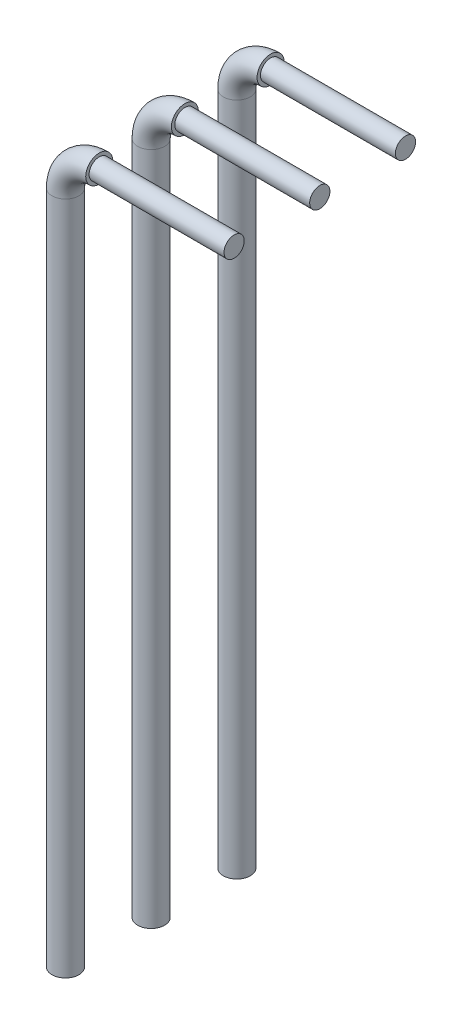
from build123d import *

# Parameters (mm, degrees)
ESQUISSE2_R                = 0.4
ESQUISSE3_R                = 0.3
BOSS_EXTRU_1_DEPTH         = 4
R_P_TITION_LIN_AIRE2_COUNT = 3
R_P_TITION_LIN_AIRE2_PITCH = 2.54


with BuildPart() as part:
    # Balayage1: sweep along a path in Esquisse1
    with BuildLine(Plane.XY) as balayage1_path:
        Line((0, 0), (0, 20))
        ThreePointArc((0, 20), (0.293142298, 20.707355773), (1.000704378, 20.999999752))
    # Esquisse2 → Balayage1 (sweep)
    with BuildSketch(Plane(origin=(0, 0, 0), x_dir=(1, 0, 0), z_dir=(0, 1, 0))):
        Circle(ESQUISSE2_R)
    sweep(path=balayage1_path.line)

    # Esquisse3 → Boss.-Extru.1 (add)
    with BuildSketch(Plane(origin=(0.985911939, -0.000694455, 0), x_dir=(0, 0, -1), z_dir=(0.9999997519254902, -0.000704378419902238, 0))):
        with Locations((0, 21.000699417)):
            Circle(ESQUISSE3_R)
    extrude(amount=BOSS_EXTRU_1_DEPTH)


with BuildPart() as r_p_tition_lin_aire2_1:
    # Répétition linéaire2: pattern copy
    add(part.part.moved(Location(Vector(0, 0, -1) * (1 * R_P_TITION_LIN_AIRE2_PITCH))))


with BuildPart() as r_p_tition_lin_aire2_2:
    # Répétition linéaire2: pattern copy
    add(part.part.moved(Location(Vector(0, 0, -1) * (2 * R_P_TITION_LIN_AIRE2_PITCH))))


solid = Compound([part.part, r_p_tition_lin_aire2_1.part, r_p_tition_lin_aire2_2.part])
